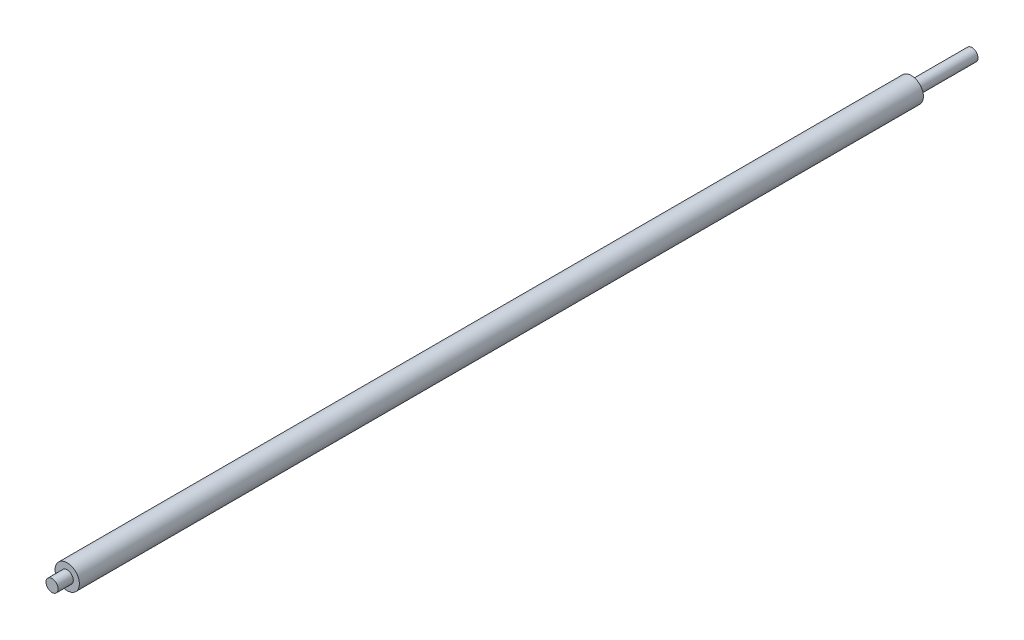
from build123d import *

# Parameters (mm, degrees)
SKETCH1_R           = 6
BOSS_EXTRUDE1_DEPTH = 208.75
SKETCH2_R           = 3
BOSS_EXTRUDE4_DEPTH = 7.5
BOSS_EXTRUDE5_START = 30
SKETCH3_R           = 3
BOSS_EXTRUDE5_DEPTH = 30


with BuildPart() as part:
    # Sketch1 → Boss-Extrude1 (new, symmetric)
    with BuildSketch(Plane.XY):
        Circle(SKETCH1_R)
    extrude(amount=BOSS_EXTRUDE1_DEPTH, both=True)

    # Sketch2 → Boss-Extrude4 (add)
    with BuildSketch(Plane.XY.offset(208.75)):
        Circle(SKETCH2_R)
    extrude(amount=BOSS_EXTRUDE4_DEPTH)

    # Sketch3 → Boss-Extrude5 (add)
    with BuildSketch(Plane(origin=(0, 0, -208.75), x_dir=(-1, 0, 0), z_dir=(0, 0, -1)).offset(BOSS_EXTRUDE5_START)):
        with Locations(Location((0, 0, 0), (0, 0, 180))):
            Circle(SKETCH3_R)
    extrude(amount=-BOSS_EXTRUDE5_DEPTH)


solid = part.part
